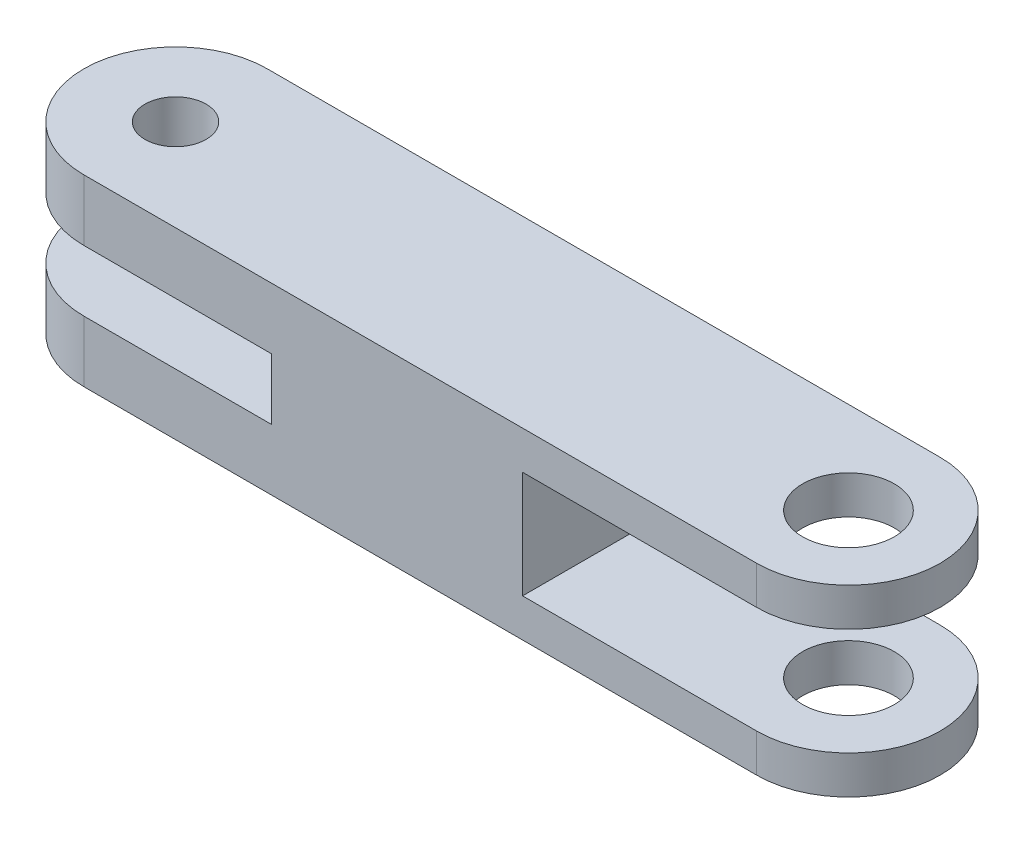
from build123d import *

# Parameters (mm, degrees)
SKETCH_1_R          = 1.5
SKETCH_1_R_2        = 1
EXTRUDE_1_DEPTH     = 3
SKETCH_6_W          = 31.511370345
SKETCH_6_H          = 11.605197544
CUT_EXTRUDE_2_DEPTH = 1.75
SKETCH_7_W          = 12.660216836
SKETCH_7_H          = 9.649927943
CUT_EXTRUDE_3_DEPTH = 1


with BuildPart() as part:
    # 草图1 → 凸台-拉伸1 (new, symmetric)
    with BuildSketch(Plane(origin=(0, 0, 0), x_dir=(1, 0, 0), z_dir=(0, 1, 0))):
        with BuildLine():
            Line((0, 3), (22, 3))
            ThreePointArc((22, 3), (25, 0), (22, -3))
            Line((22, -3), (0, -3))
            ThreePointArc((0, -3), (-3, 0), (0, 3))
        make_face()
        with Locations(Location((22, 0, 0), (0, 0, 270))):
            Circle(SKETCH_1_R, mode=Mode.SUBTRACT)
        with Locations(Location((0, 0, 0), (0, 0, 270))):
            Circle(SKETCH_1_R_2, mode=Mode.SUBTRACT)
    extrude(amount=EXTRUDE_1_DEPTH, both=True)

    # 草图6 → 切除-拉伸2 (cut, symmetric)
    with BuildSketch(Plane(origin=(0, 0, 0), x_dir=(1, 0, 0), z_dir=(0, 1, 0))):
        with Locations((30.101826092, 2.040608699)):
            Rectangle(SKETCH_6_W, SKETCH_6_H)
    extrude(amount=CUT_EXTRUDE_2_DEPTH, both=True, mode=Mode.SUBTRACT)

    # 草图7 → 切除-拉伸3 (cut, symmetric)
    with BuildSketch(Plane(origin=(0, 0, 0), x_dir=(1, 0, 0), z_dir=(0, 1, 0))):
        with Locations((-0.191074288, 0.210879474)):
            Rectangle(SKETCH_7_W, SKETCH_7_H)
    extrude(amount=CUT_EXTRUDE_3_DEPTH, both=True, mode=Mode.SUBTRACT)


solid = part.part
